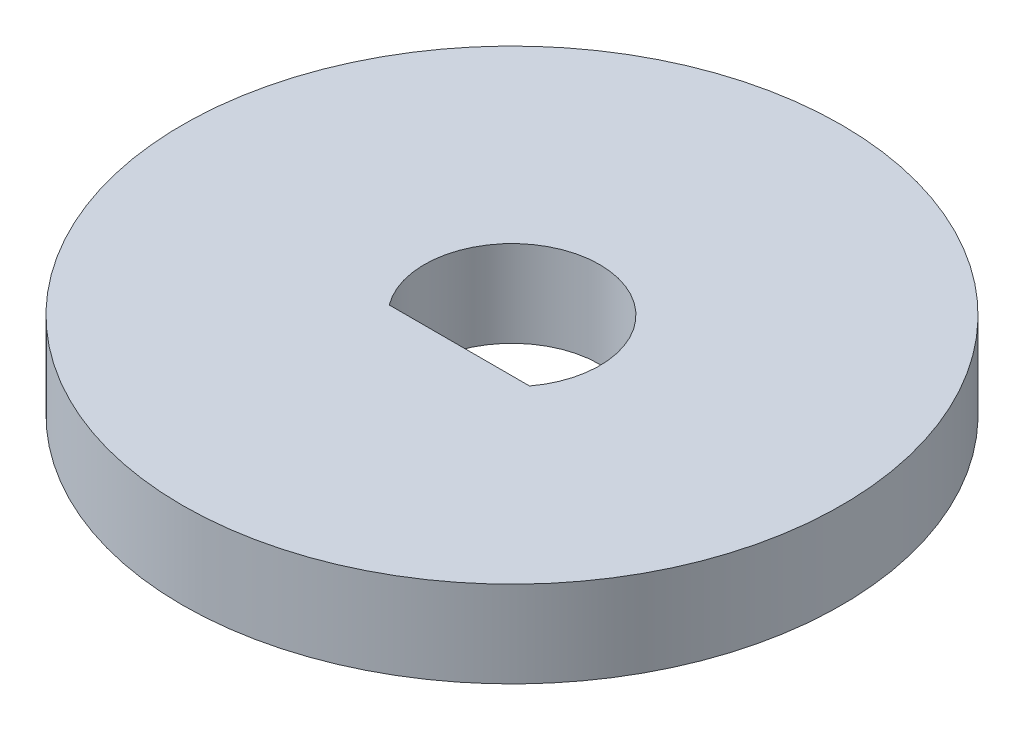
from build123d import *

# Parameters (mm, degrees)
SKETCH1_R           = 9.398
BOSS_EXTRUDE1_DEPTH = 2.4638
CUT_EXTRUDE1_DEPTH  = 14.517215632


with BuildPart() as part:
    # Sketch1 → Boss-Extrude1 (new body)
    with BuildSketch(Plane(origin=(0, 0, 0), x_dir=(1, 0, 0), z_dir=(0, 1, 0))):
        with Locations(Location((0, 0, 0), (0, 0, 270))):
            Circle(SKETCH1_R)
    extrude(amount=BOSS_EXTRUDE1_DEPTH)

    # Sketch2 → Cut-Extrude1 (cut, through all)
    with BuildSketch(Plane(origin=(0, 2.4638, 0), x_dir=(1, 0, 0), z_dir=(0, 1, 0))):
        with BuildLine():
            Line((-2, -1.5), (2, -1.5))
            ThreePointArc((2, -1.5), (0, 2.5), (-2, -1.5))
        make_face()
    extrude(amount=-CUT_EXTRUDE1_DEPTH, mode=Mode.SUBTRACT)


solid = part.part
